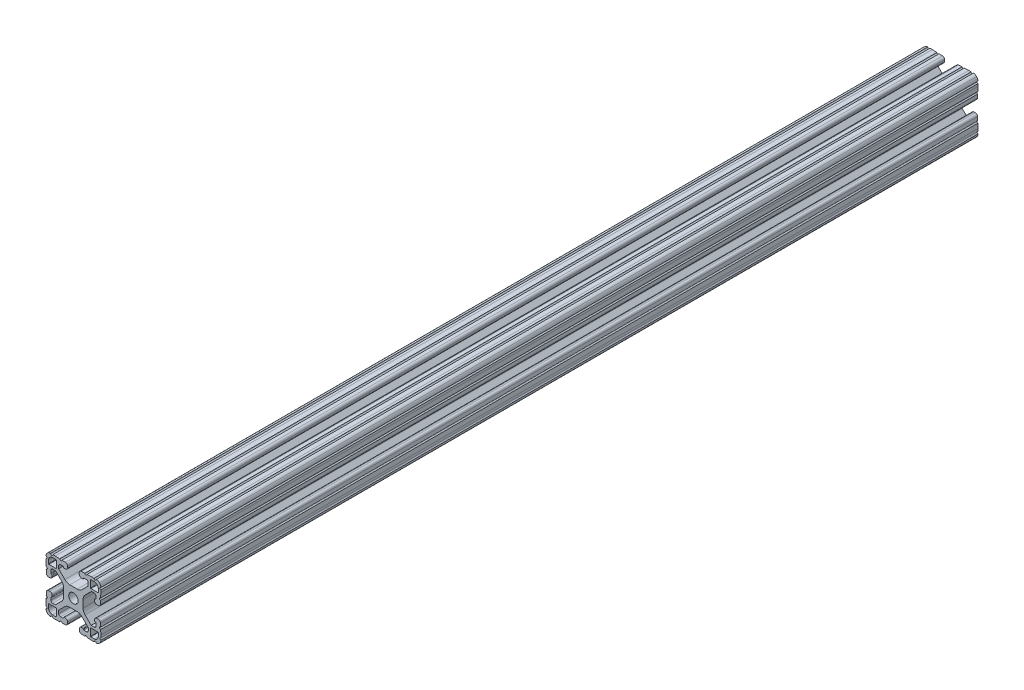
from build123d import *

# Parameters (mm, degrees)
SKETCH1_R           = 3.2639
BOSS_EXTRUDE1_DEPTH = 609.6


with BuildPart() as part:
    # Sketch1 → Boss-Extrude1 (new body)
    with BuildSketch(Plane(origin=(0, 0, -25.4), x_dir=(-1, 0, 0), z_dir=(0, 0, -1))):
        with BuildLine():
            Line((-88.043721549, 91.862643967), (-86.29674679, 91.923648859))
            ThreePointArc((-86.29674679, 91.923648859), (-85.370208675, 91.567983831), (-84.982425017, 90.654422489))
            Line((-84.982425017, 90.654422489), (-84.982425017, 88.800173916))
            Line((-84.982425017, 88.800173916), (-89.306565884, 84.476033049))
            ThreePointArc((-89.306565884, 84.476033049), (-90.866149908, 83.406077005), (-92.719610366, 83.029523439))
            Line((-92.719610366, 83.029523439), (-97.961628589, 83.029523439))
            ThreePointArc((-97.961628589, 83.029523439), (-99.779298356, 83.391080435), (-101.320244378, 84.42070765))
            Line((-101.320244378, 84.42070765), (-105.516001761, 88.616465033))
            Line((-105.516001761, 88.616465033), (-105.516001761, 90.731330035))
            ThreePointArc((-105.516001761, 90.731330035), (-105.128218103, 91.644891377), (-104.201679988, 92.000556406))
            Line((-104.201679988, 92.000556406), (-102.454705229, 91.939551513))
            ThreePointArc((-102.454705229, 91.939551513), (-102.193933359, 91.823448504), (-102.087001761, 91.558783602))
            ThreePointArc((-102.087001761, 91.558783602), (-102.010859042, 91.249291513), (-101.726191901, 91.105946874))
            Line((-101.726191901, 91.105946874), (-100.929727576, 91.078102142))
            ThreePointArc((-100.929727576, 91.078102142), (-99.780779944, 91.519102656), (-99.299905511, 92.651940638))
            Line((-99.299905511, 92.651940638), (-99.299905511, 93.566848638))
            ThreePointArc((-99.299905511, 93.566848638), (-99.741889517, 94.660796975), (-100.819746715, 95.140689345))
            Line((-100.819746715, 95.140689345), (-103.211918901, 95.224224422))
            ThreePointArc((-103.211918901, 95.224224422), (-104.000045777, 94.489281495), (-104.734990687, 95.277406522))
            Line((-104.734990687, 95.277406522), (-107.935905676, 95.389166912))
            Line((-107.935905676, 95.389166912), (-109.561454876, 95.389166912))
            ThreePointArc((-109.561454876, 95.389166912), (-110.323454876, 94.627166912), (-111.085454876, 95.389166912))
            ThreePointArc((-111.085454876, 95.389166912), (-112.308767787, 95.144035599), (-113.343184761, 94.446493225))
            ThreePointArc((-113.343184761, 94.446493225), (-114.04072548, 93.412075135), (-114.285854836, 92.188761832))
            ThreePointArc((-114.285854836, 92.188761832), (-113.523853616, 91.426762441), (-114.285853616, 90.664761832))
            Line((-114.285853616, 90.664761832), (-114.285853616, 89.039212632))
            Line((-114.285853616, 89.039212632), (-114.174093219, 85.838297643))
            ThreePointArc((-114.174093219, 85.838297643), (-113.385968191, 85.103352735), (-114.120911115, 84.315225857))
            Line((-114.120911115, 84.315225857), (-114.037376031, 81.923053667))
            ThreePointArc((-114.037376031, 81.923053667), (-113.55748366, 80.845196472), (-112.463535325, 80.403212468))
            Line((-112.463535325, 80.403212468), (-111.548627325, 80.403212468))
            ThreePointArc((-111.548627325, 80.403212468), (-110.415788905, 80.884087354), (-109.974788872, 82.033035791))
            Line((-109.974788872, 82.033035791), (-110.002634241, 82.829500094))
            ThreePointArc((-110.002634241, 82.829500094), (-110.118742417, 83.090261917), (-110.383401914, 83.197188))
            ThreePointArc((-110.383401914, 83.197188), (-110.693757401, 83.272605688), (-110.837665276, 83.557735272))
            Line((-110.837665276, 83.557735272), (-110.898671566, 85.304709982))
            ThreePointArc((-110.898671566, 85.304709982), (-110.543006925, 86.231248747), (-109.62944523, 86.61903277))
            Line((-109.62944523, 86.61903277), (-107.807161806, 86.61903277))
            Line((-107.807161806, 86.61903277), (-103.364925613, 82.176810793))
            ThreePointArc((-103.364925613, 82.176810793), (-102.335294479, 80.635862907), (-101.973736029, 78.81818963))
            Line((-101.973736029, 78.81818963), (-101.973736029, 73.576034207))
            ThreePointArc((-101.973736029, 73.576034207), (-102.335293752, 71.758362684), (-103.364922926, 70.21741573))
            Line((-103.364922926, 70.21741573), (-107.560683666, 66.021661704))
            Line((-107.560683666, 66.021661704), (-109.652436558, 66.021661704))
            ThreePointArc((-109.652436558, 66.021661704), (-110.565998503, 66.409445617), (-110.921663765, 67.335984343))
            Line((-110.921663765, 67.335984343), (-110.860658873, 69.082959102))
            ThreePointArc((-110.860658873, 69.082959102), (-110.744555864, 69.343730973), (-110.479890961, 69.45066257))
            ThreePointArc((-110.479890961, 69.45066257), (-110.173494703, 69.529390272), (-110.032185196, 69.812424443))
            Line((-110.032185196, 69.812424443), (-110.004340464, 70.608888768))
            ThreePointArc((-110.004340464, 70.608888768), (-110.445340978, 71.7578364), (-111.57817896, 72.238710833))
            Line((-111.57817896, 72.238710833), (-112.49308696, 72.238710833))
            ThreePointArc((-112.49308696, 72.238710833), (-113.587035297, 71.796726827), (-114.066927667, 70.718869629))
            Line((-114.066927667, 70.718869629), (-114.150462744, 68.326697443))
            ThreePointArc((-114.150462744, 68.326697443), (-113.415519817, 67.538570567), (-114.203644843, 66.803625657))
            Line((-114.203644843, 66.803625657), (-114.315405233, 63.602710668))
            Line((-114.315405233, 63.602710668), (-114.315405233, 61.962557497))
            ThreePointArc((-114.315405233, 61.962557497), (-113.701927281, 61.206106537), (-114.333208228, 60.464447842))
            ThreePointArc((-114.333208228, 60.464447842), (-114.113020459, 59.176546471), (-113.392816136, 58.086372941))
            ThreePointArc((-113.392816136, 58.086372941), (-112.358398046, 57.388832223), (-111.135084743, 57.143702867))
            ThreePointArc((-111.135084743, 57.143702867), (-110.373085352, 57.905704086), (-109.611084743, 57.143704086))
            Line((-109.611084743, 57.143704086), (-107.985535543, 57.143704086))
            Line((-107.985535543, 57.143704086), (-104.784620554, 57.255464483))
            ThreePointArc((-104.784620554, 57.255464483), (-104.049675645, 58.04358951), (-103.261548768, 57.308646586))
            Line((-103.261548768, 57.308646586), (-100.869376578, 57.39218167))
            ThreePointArc((-100.869376578, 57.39218167), (-99.791519383, 57.872074041), (-99.349535378, 58.966022376))
            Line((-99.349535378, 58.966022376), (-99.349535378, 59.880930376))
            ThreePointArc((-99.349535378, 59.880930376), (-99.830409811, 61.013768358), (-100.979357443, 61.454768873))
            Line((-100.979357443, 61.454768873), (-101.775821768, 61.42692414))
            ThreePointArc((-101.775821768, 61.42692414), (-102.036583684, 61.310816174), (-102.143509978, 61.046156762))
            ThreePointArc((-102.143509978, 61.046156762), (-102.222494916, 60.740061862), (-102.505377386, 60.598958297))
            Line((-102.505377386, 60.598958297), (-104.252352145, 60.537953405))
            ThreePointArc((-104.252352145, 60.537953405), (-105.17889026, 60.893618433), (-105.566673918, 61.807179775))
            Line((-105.566673918, 61.807179775), (-105.566673918, 63.629462758))
            Line((-105.566673918, 63.629462758), (-101.131142468, 68.064994208))
            ThreePointArc((-101.131142468, 68.064994208), (-99.590196446, 69.094621422), (-97.772526678, 69.456178419))
            Line((-97.772526678, 69.456178419), (-92.530356056, 69.456178419))
            ThreePointArc((-92.530356056, 69.456178419), (-90.712686289, 69.094621422), (-89.171740267, 68.064994208))
            Line((-89.171740267, 68.064994208), (-84.975982884, 63.869236825))
            Line((-84.975982884, 63.869236825), (-84.975982884, 61.781050107))
            ThreePointArc((-84.975982884, 61.781050107), (-85.363766542, 60.867488765), (-86.290304657, 60.511823736))
            Line((-86.290304657, 60.511823736), (-88.037279416, 60.572828629))
            ThreePointArc((-88.037279416, 60.572828629), (-88.298051286, 60.688931638), (-88.404982884, 60.95359654))
            ThreePointArc((-88.404982884, 60.95359654), (-88.466593694, 61.278962759), (-88.759626911, 61.433204782))
            Line((-88.759626911, 61.433204782), (-89.556091237, 61.461049514))
            ThreePointArc((-89.556091237, 61.461049514), (-90.705038868, 61.020049), (-91.185913301, 59.887211018))
            Line((-91.185913301, 59.887211018), (-91.185913301, 58.972303018))
            ThreePointArc((-91.185913301, 58.972303018), (-90.743929295, 57.878354681), (-89.666072098, 57.398462311))
            Line((-89.666072098, 57.398462311), (-87.273899911, 57.314927234))
            ThreePointArc((-87.273899911, 57.314927234), (-86.485773036, 58.049870161), (-85.750828126, 57.261745135))
            Line((-85.750828126, 57.261745135), (-82.549913136, 57.149984745))
            Line((-82.549913136, 57.149984745), (-80.924363936, 57.149984745))
            ThreePointArc((-80.924363936, 57.149984745), (-80.162363936, 57.911984745), (-79.400363936, 57.149984745))
            ThreePointArc((-79.400363936, 57.149984745), (-78.177051025, 57.395116058), (-77.142634052, 58.092658432))
            ThreePointArc((-77.142634052, 58.092658432), (-76.445094372, 59.127074031), (-76.199963977, 60.350384428))
            ThreePointArc((-76.199963977, 60.350384428), (-76.961961268, 61.112385783), (-76.199961268, 61.874384428))
            Line((-76.199961268, 61.874384428), (-76.199961268, 63.499933628))
            Line((-76.199961268, 63.499933628), (-76.311721666, 66.700848617))
            ThreePointArc((-76.311721666, 66.700848617), (-77.099846694, 67.435793525), (-76.364903769, 68.223920403))
            Line((-76.364903769, 68.223920403), (-76.448438853, 70.616092593))
            ThreePointArc((-76.448438853, 70.616092593), (-76.928331225, 71.693949788), (-78.02227956, 72.135933792))
            Line((-78.02227956, 72.135933792), (-78.93718756, 72.135933792))
            ThreePointArc((-78.93718756, 72.135933792), (-80.07002598, 71.655058906), (-80.511026012, 70.506110469))
            Line((-80.511026012, 70.506110469), (-80.483180643, 69.709646166))
            ThreePointArc((-80.483180643, 69.709646166), (-80.367072468, 69.448884343), (-80.102412971, 69.34195826))
            ThreePointArc((-80.102412971, 69.34195826), (-79.796317908, 69.262973649), (-79.655214052, 68.980091239))
            Line((-79.655214052, 68.980091239), (-79.594207761, 67.233116529))
            ThreePointArc((-79.594207761, 67.233116529), (-79.949872402, 66.306577764), (-80.863434097, 65.918793741))
            Line((-80.863434097, 65.918793741), (-82.685717521, 65.918793741))
            Line((-82.685717521, 65.918793741), (-87.121258001, 70.35431293))
            ThreePointArc((-87.121258001, 70.35431293), (-88.150863946, 71.895196205), (-88.512450271, 73.712794894))
            Line((-88.512450271, 73.712794894), (-88.512606864, 78.954950317))
            ThreePointArc((-88.512606864, 78.954950317), (-88.151076291, 80.772698182), (-87.121419968, 82.313710679))
            Line((-87.121419968, 82.313710679), (-82.925659228, 86.509464706))
            Line((-82.925659228, 86.509464706), (-80.837473527, 86.509464706))
            ThreePointArc((-80.837473527, 86.509464706), (-79.923911584, 86.121680793), (-79.568246321, 85.195142068))
            Line((-79.568246321, 85.195142068), (-79.629251214, 83.448167309))
            ThreePointArc((-79.629251214, 83.448167309), (-79.745354223, 83.187395438), (-80.010019125, 83.080463841))
            ThreePointArc((-80.010019125, 83.080463841), (-80.335385344, 83.018853031), (-80.489627367, 82.725819813))
            Line((-80.489627367, 82.725819813), (-80.5174721, 81.929355488))
            ThreePointArc((-80.5174721, 81.929355488), (-80.076471586, 80.780407856), (-78.943633603, 80.299533423))
            Line((-78.943633603, 80.299533423), (-78.028725603, 80.299533423))
            ThreePointArc((-78.028725603, 80.299533423), (-76.934777267, 80.741517429), (-76.454884897, 81.819374627))
            Line((-76.454884897, 81.819374627), (-76.37134982, 84.211546813))
            ThreePointArc((-76.37134982, 84.211546813), (-77.106292747, 84.999673689), (-76.31816772, 85.734618599))
            Line((-76.31816772, 85.734618599), (-76.20640733, 88.935533588))
            Line((-76.20640733, 88.935533588), (-76.20640733, 90.561082788))
            ThreePointArc((-76.20640733, 90.561082788), (-76.96840733, 91.323083398), (-76.206406111, 92.085082788))
            ThreePointArc((-76.206406111, 92.085082788), (-76.451535467, 93.308396091), (-77.149076185, 94.342814181))
            ThreePointArc((-77.149076185, 94.342814181), (-78.183493159, 95.040356555), (-79.40680607, 95.285487868))
            ThreePointArc((-79.40680607, 95.285487868), (-80.16880607, 94.523487868), (-80.93080607, 95.285487868))
            Line((-80.93080607, 95.285487868), (-82.55635527, 95.285487868))
            Line((-82.55635527, 95.285487868), (-85.757270259, 95.173727471))
            ThreePointArc((-85.757270259, 95.173727471), (-86.492215168, 94.385602444), (-87.280342045, 95.120545368))
            Line((-87.280342045, 95.120545368), (-89.672514235, 95.037010285))
            ThreePointArc((-89.672514235, 95.037010285), (-90.75037143, 94.557117913), (-91.192355435, 93.463169578))
            Line((-91.192355435, 93.463169578), (-91.192355435, 92.548261578))
            ThreePointArc((-91.192355435, 92.548261578), (-90.711481002, 91.415423596), (-89.56253337, 90.974423082))
            Line((-89.56253337, 90.974423082), (-88.766069045, 91.002267814))
            ThreePointArc((-88.766069045, 91.002267814), (-88.505307129, 91.11837578), (-88.398380835, 91.383035192))
            ThreePointArc((-88.398380835, 91.383035192), (-88.336765486, 91.708407548), (-88.043721549, 91.862643967))
        make_face()
        with Locations((-95.25, 76.2)):
            Circle(SKETCH1_R, mode=Mode.SUBTRACT)
        with BuildLine():
            Line((-83.357745393, 88.294108398), (-83.357745393, 93.170908398))
            ThreePointArc((-83.357745393, 93.170908398), (-83.283351492, 93.350512545), (-83.103748154, 93.424908398))
            Line((-83.103748154, 93.424908398), (-80.766975763, 93.424933798))
            ThreePointArc((-80.766975763, 93.424933798), (-78.791299784, 92.606600882), (-77.972945393, 90.630933798))
            Line((-77.972945393, 90.630933798), (-77.972945393, 88.294108398))
            ThreePointArc((-77.972945393, 88.294108398), (-78.047340271, 88.114503276), (-78.226945393, 88.040108398))
            Line((-78.226945393, 88.040108398), (-83.103745393, 88.040108398))
            ThreePointArc((-83.103745393, 88.040108398), (-83.283350516, 88.114503276), (-83.357745393, 88.294108398))
        make_face(mode=Mode.SUBTRACT)
        with BuildLine():
            Line((-83.357745393, 59.229091602), (-83.357745393, 64.105891602))
            ThreePointArc((-83.357745393, 64.105891602), (-83.283350516, 64.285496724), (-83.103745393, 64.359891602))
            Line((-83.103745393, 64.359891602), (-78.226945393, 64.359891602))
            ThreePointArc((-78.226945393, 64.359891602), (-78.047340271, 64.285496724), (-77.972945393, 64.105891602))
            Line((-77.972945393, 64.105891602), (-77.972945393, 61.769066202))
            ThreePointArc((-77.972945393, 61.769066202), (-78.791299784, 59.793399118), (-80.766975763, 58.975066202))
            Line((-80.766975763, 58.975066202), (-83.103748154, 58.975091602))
            ThreePointArc((-83.103748154, 58.975091602), (-83.283351492, 59.049487455), (-83.357745393, 59.229091602))
        make_face(mode=Mode.SUBTRACT)
        with BuildLine():
            Line((-107.142254607, 93.170908398), (-107.142254607, 88.294108398))
            ThreePointArc((-107.142254607, 88.294108398), (-107.216649484, 88.114503276), (-107.396254607, 88.040108398))
            Line((-107.396254607, 88.040108398), (-112.273054607, 88.040108398))
            ThreePointArc((-112.273054607, 88.040108398), (-112.452659729, 88.114503276), (-112.527054607, 88.294108398))
            Line((-112.527054607, 88.294108398), (-112.527054607, 90.630933798))
            ThreePointArc((-112.527054607, 90.630933798), (-111.708700216, 92.606600882), (-109.733024237, 93.424933798))
            Line((-109.733024237, 93.424933798), (-107.396251846, 93.424908398))
            ThreePointArc((-107.396251846, 93.424908398), (-107.216648508, 93.350512545), (-107.142254607, 93.170908398))
        make_face(mode=Mode.SUBTRACT)
        with BuildLine():
            Line((-107.142254607, 64.105891602), (-107.142254607, 59.229091602))
            ThreePointArc((-107.142254607, 59.229091602), (-107.216648508, 59.049487455), (-107.396251846, 58.975091602))
            Line((-107.396251846, 58.975091602), (-109.733024237, 58.975066202))
            ThreePointArc((-109.733024237, 58.975066202), (-111.708700216, 59.793399118), (-112.527054607, 61.769066202))
            Line((-112.527054607, 61.769066202), (-112.527054607, 64.105891602))
            ThreePointArc((-112.527054607, 64.105891602), (-112.452659729, 64.285496724), (-112.273054607, 64.359891602))
            Line((-112.273054607, 64.359891602), (-107.396254607, 64.359891602))
            ThreePointArc((-107.396254607, 64.359891602), (-107.216649484, 64.285496724), (-107.142254607, 64.105891602))
        make_face(mode=Mode.SUBTRACT)
    extrude(amount=-BOSS_EXTRUDE1_DEPTH)


solid = part.part
